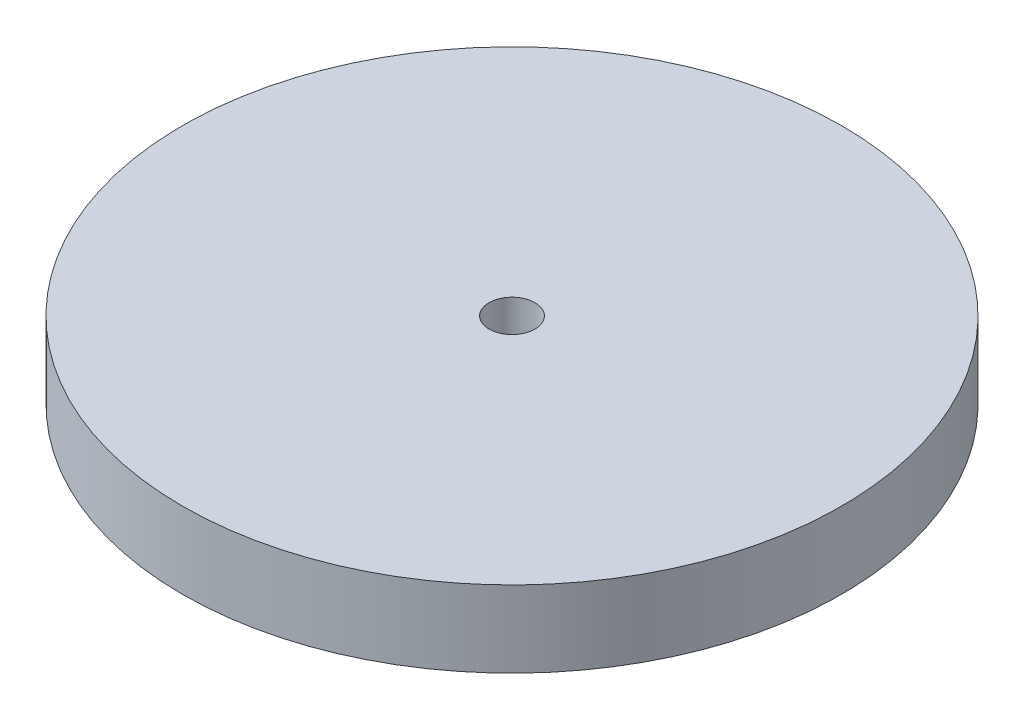
from build123d import *

# Parameters (mm, degrees)
SKETCH1_R           = 34.5
SKETCH1_R_2         = 2.4
BOSS_EXTRUDE1_DEPTH = 8


with BuildPart() as part:
    # Sketch1 → Boss-Extrude1 (new body)
    with BuildSketch(Plane(origin=(0, 0, 0), x_dir=(1, 0, 0), z_dir=(0, 1, 0))):
        with Locations(Location((0, 0, 0), (0, 0, 270))):
            Circle(SKETCH1_R)
        with Locations(Location((0, 0, 0), (0, 0, 270))):
            Circle(SKETCH1_R_2, mode=Mode.SUBTRACT)
    extrude(amount=BOSS_EXTRUDE1_DEPTH)


solid = part.part
